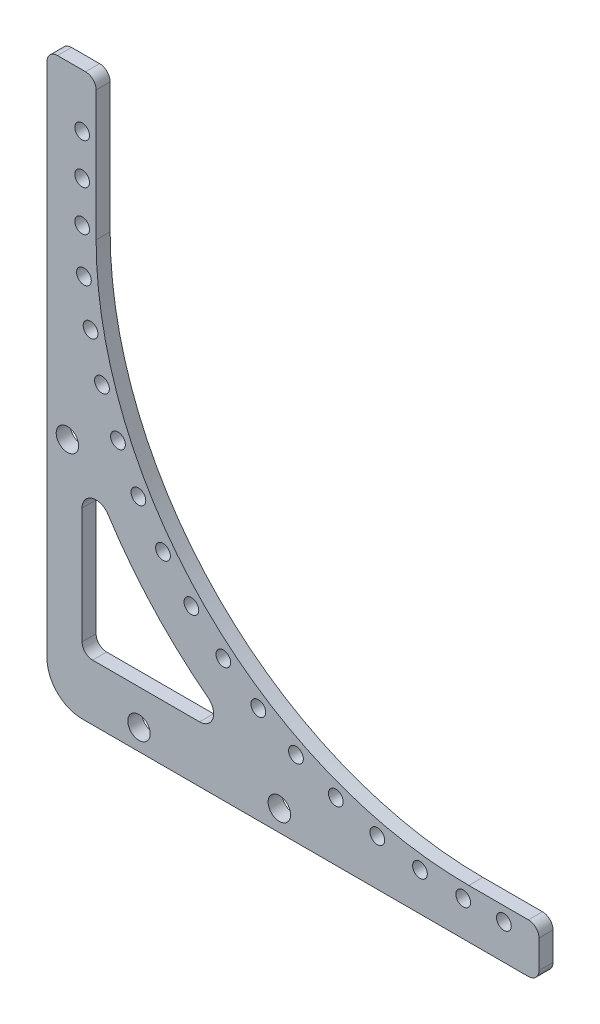
from build123d import *

# Parameters (mm, degrees)
EXTRUDE_1_DEPTH     = 2
SKETCH_2_R          = 1.05
CUT_EXTRUDE_1_DEPTH = 2
SKETCH_3_R          = 1.05
CUT_EXTRUDE_2_DEPTH = 2
FILLET_1_R          = 5
FILLET_2_R          = 1.5
SKETCH_5_R          = 1.6
CUT_EXTRUDE_4_DEPTH = 10
SKETCH_6_R          = 1.6
CUT_EXTRUDE_5_DEPTH = 10
CUT_EXTRUDE_6_DEPTH = 10
FILLET_3_R          = 2
FILLET_4_R          = 1.5
SKETCH_10_R         = 1.05
CUT_EXTRUDE_7_DEPTH = 10


with BuildPart() as part:
    # 草图1 → 凸台-拉伸1 (new body)
    with BuildSketch(Plane.XY):
        with BuildLine():
            Line((-53.112698372, 0), (-53.112698372, 20))
            Line((-53.112698372, 20), (-60.112698372, 20))
            Line((-60.112698372, 20), (-60.112698372, -60.112698372))
            Line((-60.112698372, -60.112698372), (10, -60.112698372))
            Line((10, -60.112698372), (10, -53.112698372))
            Line((10, -53.112698372), (0, -53.112698372))
            ThreePointArc((0, -53.112698372), (-37.556349186, -37.556349186), (-53.112698372, 0))
        make_face()
    extrude(amount=EXTRUDE_1_DEPTH)

    # 草图2 → 切除-拉伸1 (cut)
    with BuildSketch(Plane.XY.offset(2)):
        with Locations((5, -55.112698372)):
            Circle(SKETCH_2_R)
    extrude(amount=-CUT_EXTRUDE_1_DEPTH, mode=Mode.SUBTRACT)

    # 草图3 → 切除-拉伸2 (cut)
    with BuildSketch(Plane.XY.offset(2)):
        with Locations((-0.799997093, -55.106891824)):
            Circle(SKETCH_3_R)
        with Locations((-6.964981152, -54.670819999)):
            Circle(SKETCH_3_R)
        with Locations((-13.042376532, -53.547230893)):
            Circle(SKETCH_3_R)
        with Locations((-18.95575646, -51.750254288)):
            Circle(SKETCH_3_R)
        with Locations((-24.630756751, -49.30248821)):
            Circle(SKETCH_3_R)
        with Locations((-29.996010986, -46.234714737)):
            Circle(SKETCH_3_R)
        with Locations((-34.984047978, -42.5855129)):
            Circle(SKETCH_3_R)
        with Locations((-39.532140269, -38.400773529)):
            Circle(SKETCH_3_R)
        with Locations((-43.583092958, -33.733122151)):
            Circle(SKETCH_3_R)
        with Locations((-47.085962967, -28.641257189)):
            Circle(SKETCH_3_R)
        with Locations((-49.996699671, -23.1892118)):
            Circle(SKETCH_3_R)
        with Locations((-52.278698867, -17.445548618)):
            Circle(SKETCH_3_R)
        with Locations((-53.903263093, -11.48249754)):
            Circle(SKETCH_3_R)
        with Locations((-54.84996251, -5.375047393)):
            Circle(SKETCH_3_R)
        with Locations((-55.106891824, 0.799997093)):
            Circle(SKETCH_3_R)
    extrude(amount=-CUT_EXTRUDE_2_DEPTH, mode=Mode.SUBTRACT)

    # 圆角1
    fillet_1_edges = [part.edges().sort_by_distance(p)[0] for p in [
        (-60.112698372, -60.112698372, 1),
    ]]
    fillet(fillet_1_edges, radius=FILLET_1_R)

    # 圆角2
    fillet_2_edges = [part.edges().sort_by_distance(p)[0] for p in [
        (-60.112698372, 20, 1),
        (-53.112698372, 20, 1),
        (10, -53.112698372, 1),
        (10, -60.112698372, 1),
    ]]
    fillet(fillet_2_edges, radius=FILLET_2_R)

    # 草图5 → 切除-拉伸4 (cut)
    with BuildSketch(Plane.XY.offset(2)):
        with Locations((-57.199529996, -26.67257888)):
            Circle(SKETCH_5_R)
    extrude(amount=-CUT_EXTRUDE_4_DEPTH, mode=Mode.SUBTRACT)

    # 草图6 → 切除-拉伸5 (cut)
    with BuildSketch(Plane(origin=(0, 0, 0), x_dir=(-1, 0, 0), z_dir=(0, 0, -1))):
        with Locations((27, -57.112698372)):
            Circle(SKETCH_6_R)
        with Locations((47, -57.112698372)):
            Circle(SKETCH_6_R)
    extrude(amount=-CUT_EXTRUDE_5_DEPTH, mode=Mode.SUBTRACT)

    # 草图7 → 切除-拉伸6 (cut)
    with BuildSketch(Plane.XY.offset(2)):
        with BuildLine():
            Line((-55.112698372, -52.112698372), (-55.112698372, -26.407430403))
            ThreePointArc((-55.112698372, -26.407430403), (-45.375761756, -40.936562477), (-31.922226907, -52.112698372))
            Line((-31.922226907, -52.112698372), (-55.112698372, -52.112698372))
        make_face()
    extrude(amount=-CUT_EXTRUDE_6_DEPTH, mode=Mode.SUBTRACT)

    # 圆角3
    fillet_3_edges = [part.edges().sort_by_distance(p)[0] for p in [
        (-31.922226907, -52.112698372, 1),
        (-55.112698372, -26.407430403, 1),
    ]]
    fillet(fillet_3_edges, radius=FILLET_3_R)

    # 圆角4
    fillet_4_edges = [part.edges().sort_by_distance(p)[0] for p in [
        (-55.112698372, -52.112698372, 1),
    ]]
    fillet(fillet_4_edges, radius=FILLET_4_R)

    # 草图10 → 切除-拉伸7 (cut)
    with BuildSketch(Plane.XY.offset(2)):
        with Locations((-55.106891824, 0.799997093)):
            Circle(SKETCH_10_R)
        with Locations((-55.106891824, 6.599997093)):
            Circle(SKETCH_10_R)
        with Locations((-55.106891824, 12.399997093)):
            Circle(SKETCH_10_R)
    extrude(amount=-CUT_EXTRUDE_7_DEPTH, mode=Mode.SUBTRACT)


solid = part.part
